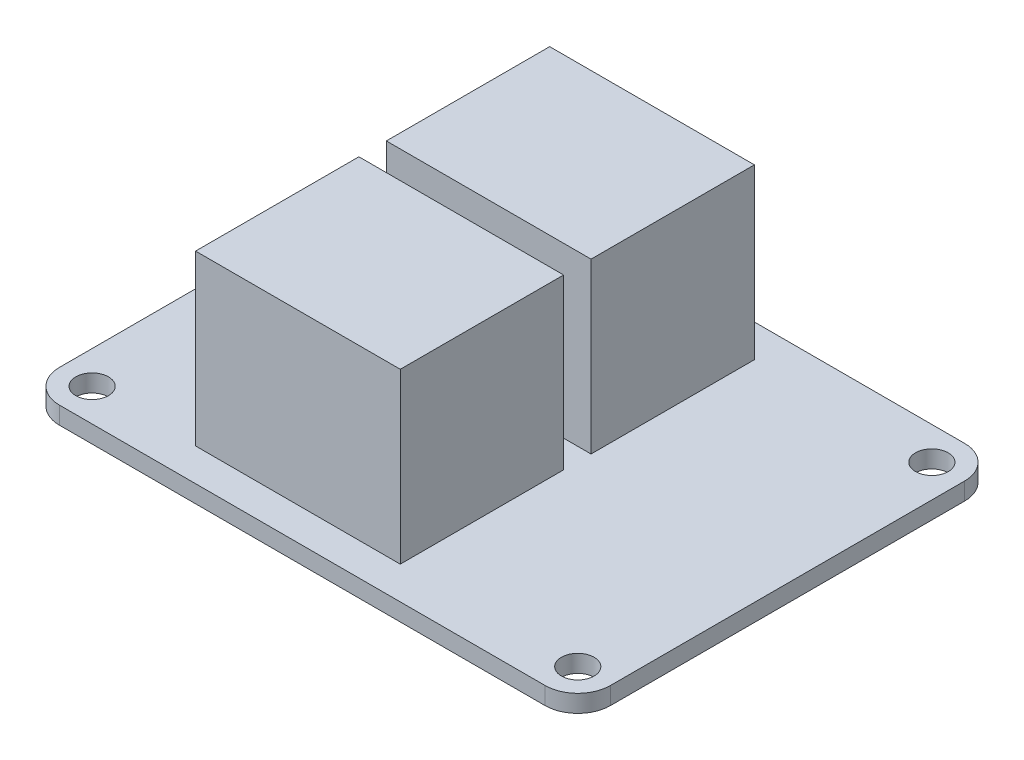
from build123d import *

# Parameters (mm, degrees)
SKETCH1_W           = 50.6
SKETCH1_H           = 38.52
SKETCH1_R           = 1.5
BOSS_EXTRUDE1_DEPTH = 1.6
FILLET1_R           = 3
FILLET2_R           = 3
FILLET3_R           = 3
FILLET4_R           = 3
SKETCH2_W           = 18.8
SKETCH2_H           = 15
BOSS_EXTRUDE2_DEPTH = 15.5


with BuildPart() as part:
    # Sketch1 → Boss-Extrude1 (new body)
    with BuildSketch(Plane(origin=(0, 0, 0), x_dir=(1, 0, 0), z_dir=(0, 1, 0))):
        with Locations((-8.389974293, -4.106015424)):
            Rectangle(SKETCH1_W, SKETCH1_H)
        with Locations(Location((13.910025707, 12.153984576, 0), (0, 0, 270))):
            Circle(SKETCH1_R, mode=Mode.SUBTRACT)
        with Locations(Location((13.910025707, -20.366015424, 0), (0, 0, 270))):
            Circle(SKETCH1_R, mode=Mode.SUBTRACT)
        with Locations(Location((-30.689974293, -20.366015424, 0), (0, 0, 270))):
            Circle(SKETCH1_R, mode=Mode.SUBTRACT)
        with Locations(Location((-30.689974293, 12.153984576, 0), (0, 0, 270))):
            Circle(SKETCH1_R, mode=Mode.SUBTRACT)
    extrude(amount=BOSS_EXTRUDE1_DEPTH)

    # Fillet1
    fillet1_edges = [part.edges().sort_by_distance(p)[0] for p in [
        (16.910025707, 0.8, -15.153984576),
    ]]
    fillet(fillet1_edges, radius=FILLET1_R)

    # Fillet2
    fillet2_edges = [part.edges().sort_by_distance(p)[0] for p in [
        (-33.689974293, 0.8, -15.153984576),
    ]]
    fillet(fillet2_edges, radius=FILLET2_R)

    # Fillet3
    fillet3_edges = [part.edges().sort_by_distance(p)[0] for p in [
        (-33.689974293, 0.8, 23.366015424),
    ]]
    fillet(fillet3_edges, radius=FILLET3_R)

    # Fillet4
    fillet4_edges = [part.edges().sort_by_distance(p)[0] for p in [
        (16.910025707, 0.8, 23.366015424),
    ]]
    fillet(fillet4_edges, radius=FILLET4_R)

    # Sketch2 → Boss-Extrude2 (add)
    with BuildSketch(Plane(origin=(0, 1.6, 0), x_dir=(1, 0, 0), z_dir=(0, 1, 0))):
        with Locations((-11.789974293, 4.653984576)):
            Rectangle(SKETCH2_W, SKETCH2_H)
        with Locations((-11.789974293, -12.866015424)):
            Rectangle(SKETCH2_W, SKETCH2_H)
    extrude(amount=BOSS_EXTRUDE2_DEPTH)


solid = part.part
